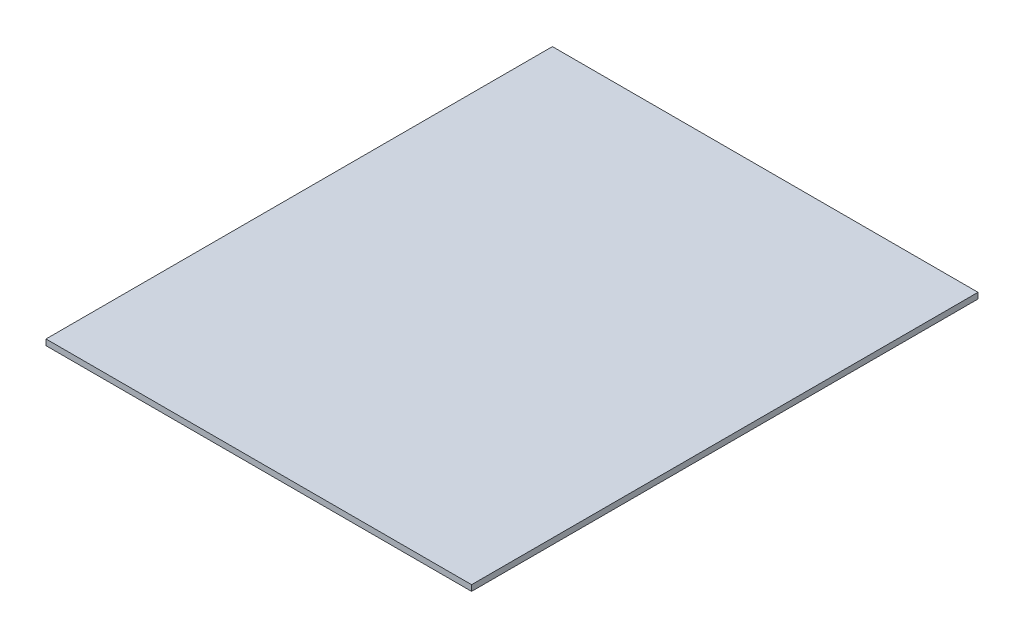
from build123d import *

# Parameters (mm, degrees)
SKETCH1_W           = 218.5
SKETCH1_H           = 260
BOSS_EXTRUDE1_DEPTH = 3


with BuildPart() as part:
    # Sketch1 → Boss-Extrude1 (new body)
    with BuildSketch(Plane(origin=(0, 0, 0), x_dir=(1, 0, 0), z_dir=(0, 1, 0))):
        Rectangle(SKETCH1_W, SKETCH1_H)
    extrude(amount=BOSS_EXTRUDE1_DEPTH)


solid = part.part
